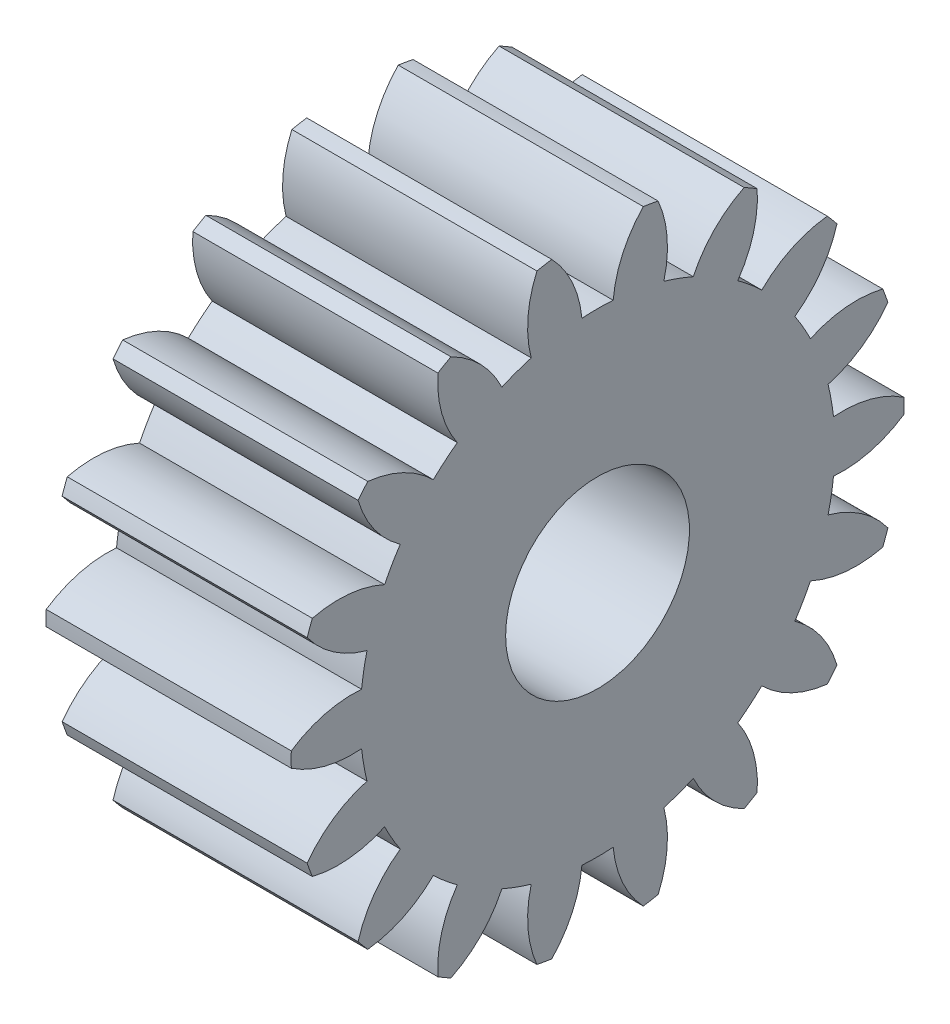
from build123d import *

# Parameters (mm, degrees)
BASPROSKE_W     = 4
BASPROSKE_H     = 5
TOOTHCUT_DEPTH  = 9.124038405
TEETHCUTS_COUNT = 18
TEETHCUTS_ANGLE = 340
BORSKE_R        = 1.5
BORE_DEPTH      = 50.0000508


with BuildPart() as part:
    # BasProSke → Base-Revolve (revolve)
    with BuildSketch(Plane(origin=(0, 0, 0), x_dir=(1, 0, 0), z_dir=(0, 1, 0)), mode=Mode.PRIVATE) as base_revolve_sk:
        with Locations((2, 2.5)):
            Rectangle(BASPROSKE_W, BASPROSKE_H)
    revolve(base_revolve_sk.sketch.rotate(Axis((-10, 0, 0), (1, 0, 0)), 180), axis=Axis((-10, 0, 0), (1, 0, 0)))

    # TooCutSke → ToothCut (cut, through all)
    with BuildSketch(Plane(origin=(0, 0, 0), x_dir=(0, 0, -1), z_dir=(1, 0, 0))):
        with BuildLine():
            ThreePointArc((0.25527463, 3.865580275), (0, 3.874), (-0.25527463, 3.865580275))
            ThreePointArc((-0.25527463, 3.865580275), (-0.416281865, 4.46052923), (-0.768562654, 4.96628197))
            ThreePointArc((-0.768562654, 4.96628197), (0, 5.0254), (0.768562654, 4.96628197))
            ThreePointArc((0.768562654, 4.96628197), (0.416281865, 4.46052923), (0.25527463, 3.865580275))
        make_face()
    toothcut = extrude(amount=TOOTHCUT_DEPTH, mode=Mode.SUBTRACT)

    # TeethCuts: ToothCut ×18 about axis
    teethcuts_axis = Axis((-10, 0, 0), (1, 0, 0))
    for i in range(1, TEETHCUTS_COUNT):
        add(toothcut.rotate(teethcuts_axis, i * TEETHCUTS_ANGLE / (TEETHCUTS_COUNT - 1)), mode=Mode.SUBTRACT)

    # BorSke → Bore (cut, symmetric)
    with BuildSketch(Plane(origin=(0, 0, 0), x_dir=(0, 0, -1), z_dir=(1, 0, 0))):
        with Locations(Location((0, 0, 0), (0, 0, 180))):
            Circle(BORSKE_R)
    extrude(amount=BORE_DEPTH, both=True, mode=Mode.SUBTRACT)


solid = part.part
